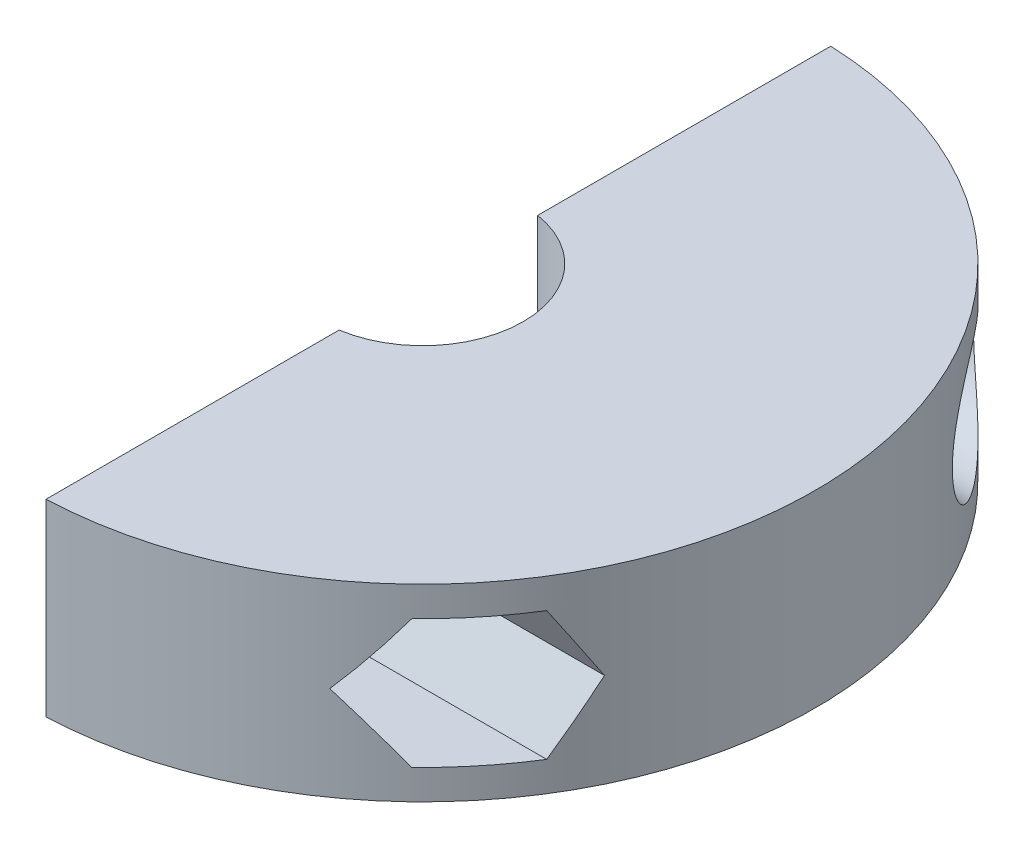
from build123d import *

# Parameters (mm, degrees)
EXTRUDE_1_DEPTH     = 6
SKETCH_2_R          = 1.1
CUT_EXTRUDE_1_DEPTH = 19.661457607
CUT_EXTRUDE_START   = 4
SKETCH_3_R          = 2.05
CUT_EXTRUDE_2_DEPTH = 15.661457773


with BuildPart() as part:
    # Эскиз1 → Бобышка-Вытянуть1 (new body)
    with BuildSketch(Plane(origin=(0, 0, 0), x_dir=(1, 0, 0), z_dir=(0, 1, 0))):
        with BuildLine():
            ThreePointArc((12.5, 0), (9.013878189, 8.660254038), (0.5, 12.489995997))
            Line((0.5, 12.489995997), (0.5, 3.160696126))
            ThreePointArc((0.5, 3.160696126), (2.433105012, 2.078460969), (3.2, 0))
            ThreePointArc((3.2, 0), (2.433105012, -2.078460969), (0.5, -3.160696126))
            Line((0.5, -3.160696126), (0.5, -12.489995997))
            ThreePointArc((0.5, -12.489995997), (9.013878189, -8.660254038), (12.5, 0))
        make_face()
    extrude(amount=EXTRUDE_1_DEPTH)

    # Эскиз2 → Вырез-Вытянуть1 (cut, through all)
    with BuildSketch(Plane(origin=(0, 0, 0), x_dir=(0, 0, -1), z_dir=(1, 0, 0))):
        with Locations(Location((7.825346061, 3, 0), (0, 0, 180))):
            Circle(SKETCH_2_R)
        with Locations(Location((-7.825346061, 3, 0), (0, 0, 180))):
            Circle(SKETCH_2_R)
    extrude(amount=CUT_EXTRUDE_1_DEPTH, mode=Mode.SUBTRACT)

    # Эскиз3 → Вырез-Вытянуть2 (cut, through all)
    with BuildSketch(Plane(origin=(0, 0, 0), x_dir=(0, 0, -1), z_dir=(1, 0, 0)).offset(CUT_EXTRUDE_START)):
        with Locations(Location((7.825346061, 3, 0), (0, 0, 180))):
            Circle(SKETCH_3_R)
        Polygon((-9.008914113, 0.95), (-6.641778009, 0.95), (-5.458209958, 3), (-6.641778009, 5.05), (-9.008914113, 5.05), (-10.192482165, 3), align=None)
    extrude(amount=CUT_EXTRUDE_2_DEPTH, mode=Mode.SUBTRACT)


solid = part.part
